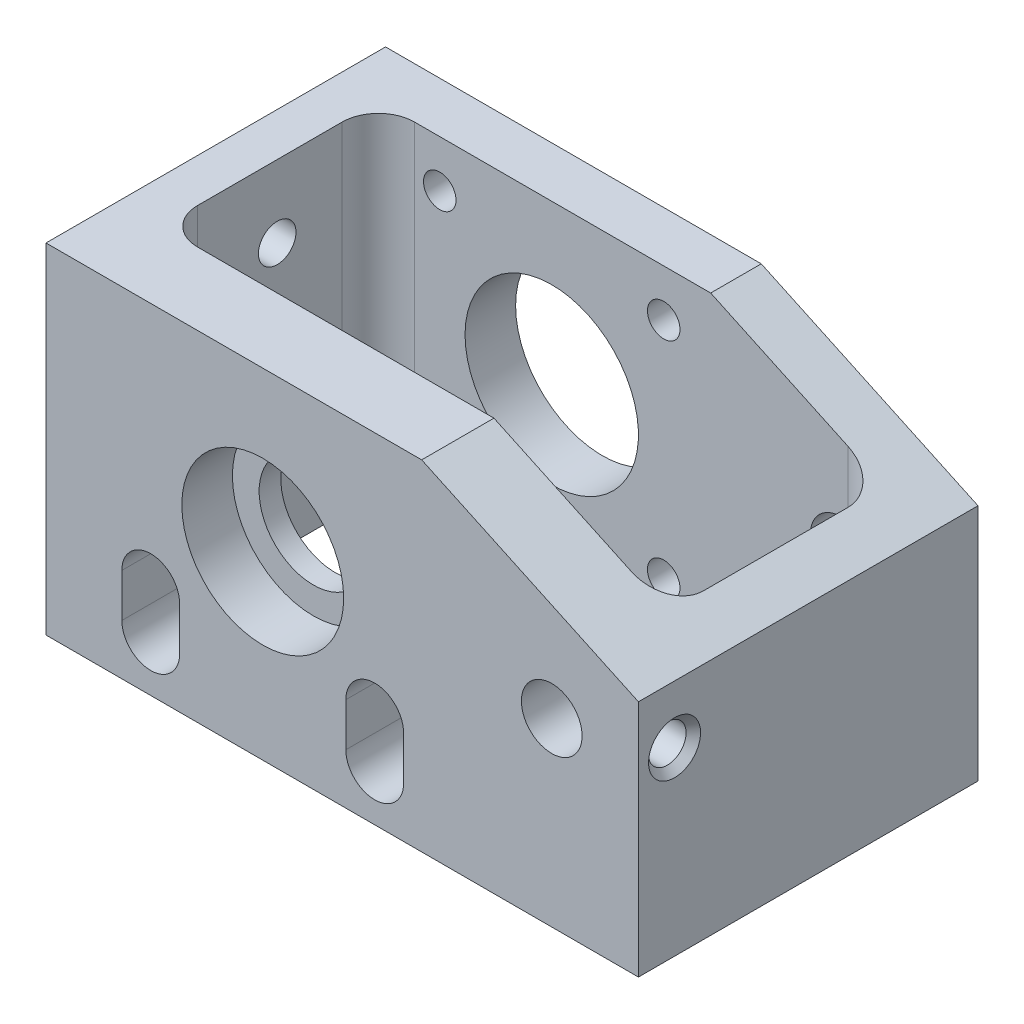
from build123d import *

# Parameters (mm, degrees)
SKETCH1_R           = 7.5
SKETCH1_R_2         = 4.2
BOSS_EXTRUDE1_DEPTH = 47
SKETCH2_R           = 11.2
CUT_EXTRUDE1_DEPTH  = 7
SKETCH3_R           = 2.25
SKETCH3_R_2         = 12
CUT_EXTRUDE2_DEPTH  = 15
CUT_EXTRUDE3_DEPTH  = 85.391942743
CUT_EXTRUDE4_DEPTH  = 20
SKETCH7_R           = 2.6
CUT_EXTRUDE5_DEPTH  = 10
SKETCH8_R           = 2.6
CUT_EXTRUDE6_DEPTH  = 8
CHAMFER1_SIZE       = 1
SKETCH9_R           = 2.6
CUT_EXTRUDE7_DEPTH  = 10
CHAMFER2_SIZE       = 1


with BuildPart() as part:
    # Sketch1 → Boss-Extrude1 (new body)
    with BuildSketch(Plane.XY):
        Polygon((-30, -25), (-30, 22), (22, 22), (52, 8), (52, -25), align=None)
        Circle(SKETCH1_R, mode=Mode.SUBTRACT)
        with Locations((40, 0)):
            Circle(SKETCH1_R_2, mode=Mode.SUBTRACT)
    extrude(amount=BOSS_EXTRUDE1_DEPTH)

    # Sketch2 → Cut-Extrude1 (cut)
    with BuildSketch(Plane.XY.offset(47)):
        Circle(SKETCH2_R)
    extrude(amount=-CUT_EXTRUDE1_DEPTH, mode=Mode.SUBTRACT)

    # Sketch3 → Cut-Extrude2 (cut)
    with BuildSketch(Plane(origin=(0, 0, 0), x_dir=(-1, 0, 0), z_dir=(0, 0, -1))):
        with Locations((-15.5, 15.5)):
            Circle(SKETCH3_R)
        with Locations((-15.5, -15.5)):
            Circle(SKETCH3_R)
        with Locations((15.5, -15.5)):
            Circle(SKETCH3_R)
        with Locations((15.5, 15.5)):
            Circle(SKETCH3_R)
        Circle(SKETCH3_R_2)
    extrude(amount=-CUT_EXTRUDE2_DEPTH, mode=Mode.SUBTRACT)

    # Sketch4 → Cut-Extrude3 (cut, through all)
    with BuildSketch(Plane(origin=(0, 22, 0), x_dir=(1, 0, 0), z_dir=(0, 1, 0))):
        with BuildLine():
            Line((-19, -7), (41, -7))
            ThreePointArc((41, -7), (44.535533906, -8.464466094), (46, -12))
            Line((46, -12), (46, -32))
            ThreePointArc((46, -32), (44.535533906, -35.535533906), (41, -37))
            Line((41, -37), (-19, -37))
            ThreePointArc((-19, -37), (-22.535533906, -35.535533906), (-24, -32))
            Line((-24, -32), (-24, -12))
            ThreePointArc((-24, -12), (-22.535533906, -8.464466094), (-19, -7))
        make_face()
    extrude(amount=-CUT_EXTRUDE3_DEPTH, mode=Mode.SUBTRACT)

    # Sketch6 → Cut-Extrude4 (cut)
    with BuildSketch(Plane.XY.offset(47)):
        with BuildLine():
            Line((-19.5, -12), (-19.5, -18))
            ThreePointArc((-19.5, -18), (-15.5, -22), (-11.5, -18))
            Line((-11.5, -18), (-11.5, -12))
            ThreePointArc((-11.5, -12), (-15.5, -8), (-19.5, -12))
        make_face()
        with BuildLine():
            Line((11.5, -12), (11.5, -18))
            ThreePointArc((11.5, -18), (15.5, -22), (19.5, -18))
            Line((19.5, -18), (19.5, -12))
            ThreePointArc((19.5, -12), (15.5, -8), (11.5, -12))
        make_face()
    extrude(amount=-CUT_EXTRUDE4_DEPTH, mode=Mode.SUBTRACT)

    # Sketch7 → Cut-Extrude5 (cut)
    with BuildSketch(Plane(origin=(52, 0, 0), x_dir=(0, 0, -1), z_dir=(1, 0, 0))):
        with Locations(Location((-42, 0, 0), (0, 0, 90))):
            Circle(SKETCH7_R)
    extrude(amount=-CUT_EXTRUDE5_DEPTH, mode=Mode.SUBTRACT)

    # Sketch8 → Cut-Extrude6 (cut)
    with BuildSketch(Plane.XZ.offset(25)):
        with Locations((-25, 42)):
            Circle(SKETCH8_R)
        with Locations((-25, 5)):
            Circle(SKETCH8_R)
        with Locations((47, 5)):
            Circle(SKETCH8_R)
        with Locations((47, 42)):
            Circle(SKETCH8_R)
    extrude(amount=-CUT_EXTRUDE6_DEPTH, mode=Mode.SUBTRACT)

    # Chamfer1
    chamfer1_edges = [part.edges().sort_by_distance(p)[0] for p in [
        (-27.6, -25, 42),
        (-27.6, -25, 5),
        (44.4, -25, 5),
        (44.4, -25, 42),
    ]]
    chamfer(chamfer1_edges, length=CHAMFER1_SIZE)

    # Sketch9 → Cut-Extrude7 (cut)
    with BuildSketch(Plane.ZY.offset(30)):
        with Locations((41, 12)):
            Circle(SKETCH9_R)
        with Locations((21, 12)):
            Circle(SKETCH9_R)
    extrude(amount=-CUT_EXTRUDE7_DEPTH, mode=Mode.SUBTRACT)

    # Chamfer2
    chamfer2_edges = [part.edges().sort_by_distance(p)[0] for p in [
        (52, -2.6, 42),
    ]]
    chamfer(chamfer2_edges, length=CHAMFER2_SIZE)


solid = part.part
